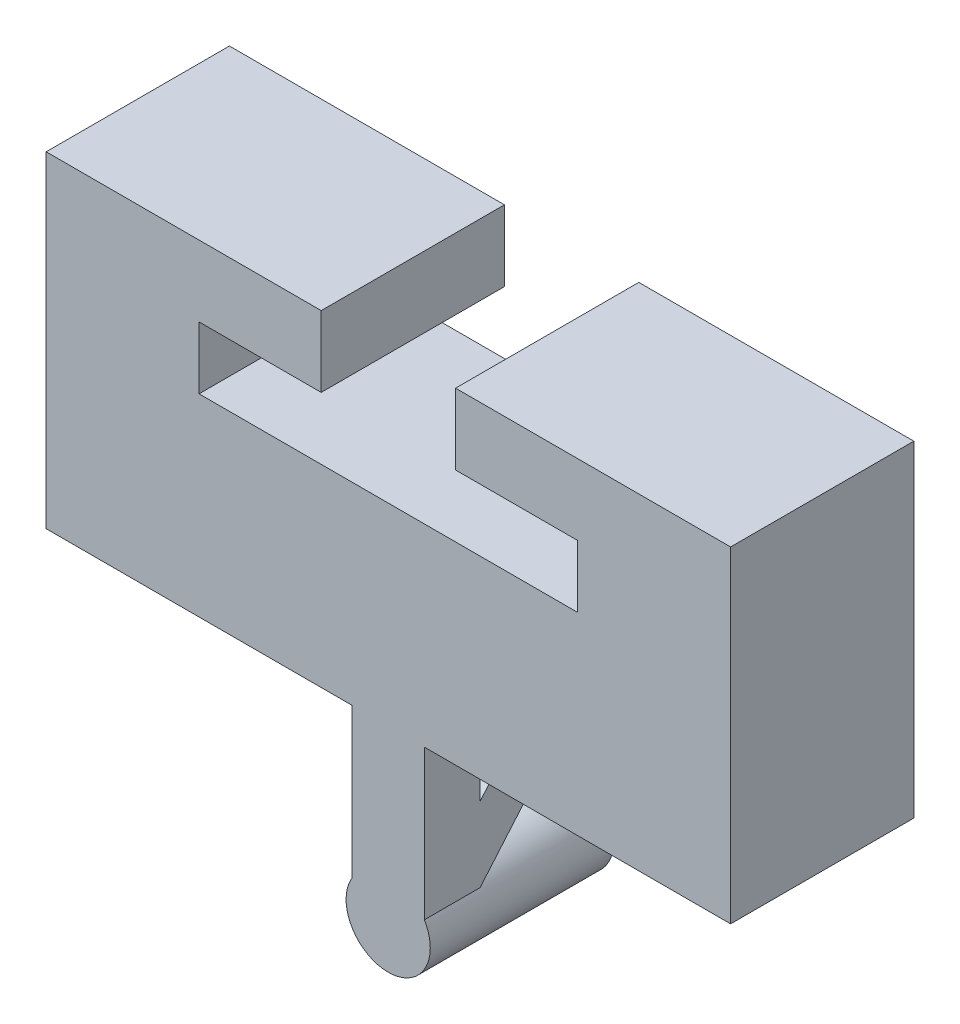
from build123d import *

# Parameters (mm, degrees)
BOSS_EXTRUDE1_DEPTH = 38.1
SKETCH2_R           = 8.7503
BOSS_EXTRUDE2_DEPTH = 38.1
BOSS_EXTRUDE6_DEPTH = 11.572281197
BOSS_EXTRUDE9_DEPTH = 15.24


with BuildPart() as part:
    # Sketch1 → Boss-Extrude1 (new body)
    with BuildSketch(Plane.XY):
        Polygon((0, 0), (142.319474343, 0), (142.319474343, 67.883016851), (85.129737171, 67.883016851), (85.129737171, 53.144138708), (110.529737171, 53.144138708), (110.529737171, 40.190138708), (31.789737171, 40.190138708), (31.789737171, 53.144138708), (57.189737171, 53.144138708), (57.189737171, 67.883016851), (0, 67.883016851), align=None)
    extrude(amount=BOSS_EXTRUDE1_DEPTH)



with BuildPart() as body_2:
    # Sketch2 → Boss-Extrude2 (new body)
    with BuildSketch(Plane.XY.offset(38.1)):
        with Locations((71.120000025, -35.559977798)):
            Circle(SKETCH2_R)
    extrude(amount=-BOSS_EXTRUDE2_DEPTH)


with BuildPart() as part_1:
    add(part.part)

    add(body_2.part)  # Boss-Extrude6 merges body 2
    # Sketch8 → Boss-Extrude6 (add)
    with BuildSketch(Plane.XY.offset(38.1)):
        with BuildLine():
            Line((63.59200581, -40.020589099), (63.59200581, 0))
            Line((63.59200581, 0), (78.647994227, 0))
            Line((78.647994227, 0), (78.647994227, -40.020589121))
            ThreePointArc((78.647994227, -40.020589121), (71.120000012, -44.310277798), (63.59200581, -40.020589099))
        make_face()
    extrude(amount=-BOSS_EXTRUDE6_DEPTH)

    # Sketch11 → Boss-Extrude9 (add)
    with BuildSketch(Plane(origin=(78.647994227, 0, 0), x_dir=(0, 0, -1), z_dir=(1, 0, 0))):
        Polygon((-26.527718803, -31.099366474), (0, 0), (-13.263859401, 0), (-26.527718803, -15.549683237), align=None)
    extrude(amount=-BOSS_EXTRUDE9_DEPTH)


solid = part_1.part
